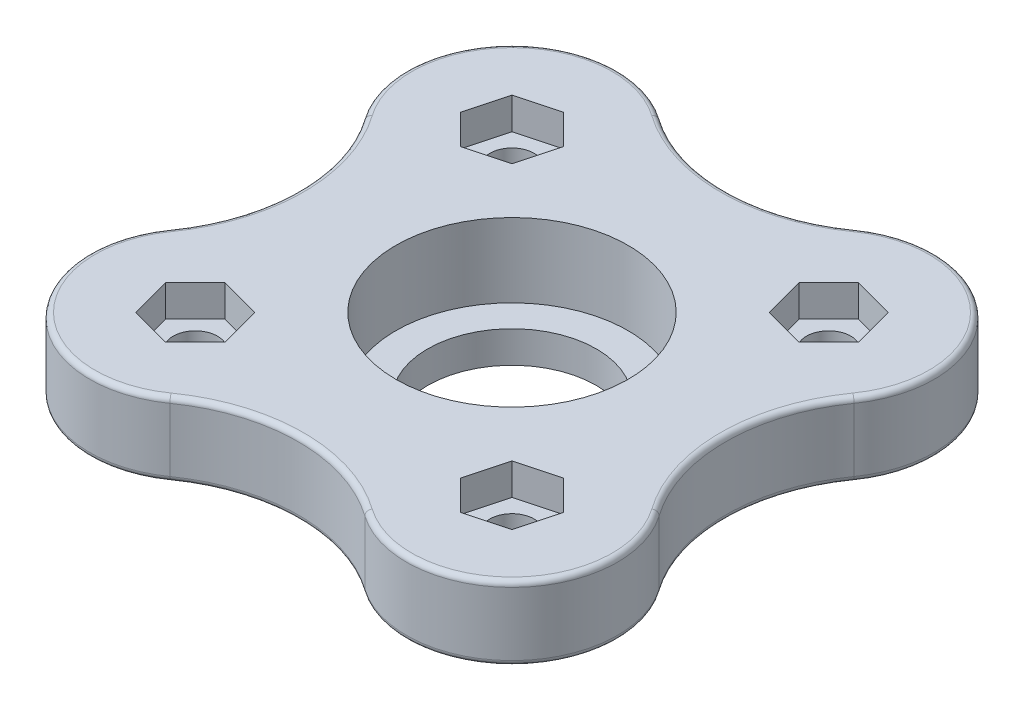
from build123d import *

# Parameters (mm, degrees)
SKETCH1_R           = 11
BOSS_EXTRUDE1_DEPTH = 7
BOSS_EXTRUDE2_START = -3
SKETCH1_3_R         = 13
SKETCH1_3_R_2       = 11
SKETCH1_3_R_3       = 8
BOSS_EXTRUDE2_DEPTH = 3
SKETCH1_4_R         = 2.1
BOSS_EXTRUDE3_DEPTH = 4
FILLET1_R           = 0.5


with BuildPart() as part:
    # Sketch1 → Boss-Extrude1 (new body)
    with BuildSketch(Plane(origin=(0, 0, 0), x_dir=(1, 0, 0), z_dir=(0, 1, 0))):
        with BuildLine():
            ThreePointArc((-23.167984839, 9.230769231), (-22.071067812, 22.071067812), (-9.230769231, 23.167984839))
            ThreePointArc((-9.230769231, 23.167984839), (0, 20.236760582), (9.230769231, 23.167984839))
            ThreePointArc((9.230769231, 23.167984839), (22.071067812, 22.071067812), (23.167984839, 9.230769231))
            ThreePointArc((23.167984839, 9.230769231), (20.236760582, 0), (23.167984839, -9.230769231))
            ThreePointArc((23.167984839, -9.230769231), (22.071067812, -22.071067812), (9.230769231, -23.167984839))
            ThreePointArc((9.230769231, -23.167984839), (0, -20.236760582), (-9.230769231, -23.167984839))
            ThreePointArc((-9.230769231, -23.167984839), (-22.071067812, -22.071067812), (-23.167984839, -9.230769231))
            ThreePointArc((-23.167984839, -9.230769231), (-20.236760582, 0), (-23.167984839, 9.230769231))
        make_face()
        with Locations(Location((0, 0, 0), (0, 0, 270))):
            Circle(SKETCH1_R, mode=Mode.SUBTRACT)
        Polygon((-12.183086796, 12.183086796), (-11.152025003, 16.031061793), (-13.968938207, 18.847974997), (-17.816913204, 17.816913204), (-18.847974997, 13.968938207), (-16.031061793, 11.152025003), align=None, mode=Mode.SUBTRACT)
        Polygon((11.152025003, 16.031061793), (12.183086796, 12.183086796), (16.031061793, 11.152025003), (18.847974997, 13.968938207), (17.816913204, 17.816913204), (13.968938207, 18.847974997), align=None, mode=Mode.SUBTRACT)
        Polygon((11.152025003, -16.031061793), (13.968938207, -18.847974997), (17.816913204, -17.816913204), (18.847974997, -13.968938207), (16.031061793, -11.152025003), (12.183086796, -12.183086796), align=None, mode=Mode.SUBTRACT)
        Polygon((-11.152025003, -16.031061793), (-12.183086796, -12.183086796), (-16.031061793, -11.152025003), (-18.847974997, -13.968938207), (-17.816913204, -17.816913204), (-13.968938207, -18.847974997), align=None, mode=Mode.SUBTRACT)
    extrude(amount=BOSS_EXTRUDE1_DEPTH)

    # Sketch1<3> → Boss-Extrude2 (add)
    # profile 1 of 2: a face of its own
    with BuildSketch(Plane(origin=(0, 0, 0), x_dir=(1, 0, 0), z_dir=(0, 1, 0)).offset(BOSS_EXTRUDE2_START)):
        with Locations(Location((0, 0, 0), (0, 0, 270))):
            Circle(SKETCH1_3_R)
        with Locations(Location((0, 0, 0), (0, 0, 270))):
            Circle(SKETCH1_3_R_2, mode=Mode.SUBTRACT)
    # profile 2 of 2: a face of its own
    with BuildSketch(Plane(origin=(0, 0, 0), x_dir=(1, 0, 0), z_dir=(0, 1, 0)).offset(BOSS_EXTRUDE2_START)):
        with Locations(Location((0, 0, 0), (0, 0, 270))):
            Circle(SKETCH1_3_R_2)
        with Locations(Location((0, 0, 0), (0, 0, 270))):
            Circle(SKETCH1_3_R_3, mode=Mode.SUBTRACT)
    extrude(amount=BOSS_EXTRUDE2_DEPTH)

    # Sketch1<4> → Boss-Extrude3 (add)
    # profile 1 of 4: a face of its own
    with BuildSketch(Plane(origin=(0, 0, 0), x_dir=(1, 0, 0), z_dir=(0, 1, 0))):
        Polygon((-17.816913204, -17.816913204), (-13.968938207, -18.847974997), (-11.152025003, -16.031061793), (-12.183086796, -12.183086796), (-16.031061793, -11.152025003), (-18.847974997, -13.968938207), align=None)
        with Locations(Location((-15, -15, 0), (0, 0, 270))):
            Circle(SKETCH1_4_R, mode=Mode.SUBTRACT)
    # profile 2 of 4: a face of its own
    with BuildSketch(Plane(origin=(0, 0, 0), x_dir=(1, 0, 0), z_dir=(0, 1, 0))):
        Polygon((-18.847974997, 13.968938207), (-16.031061793, 11.152025003), (-12.183086796, 12.183086796), (-11.152025003, 16.031061793), (-13.968938207, 18.847974997), (-17.816913204, 17.816913204), align=None)
        with Locations(Location((-15, 15, 0), (0, 0, 270))):
            Circle(SKETCH1_4_R, mode=Mode.SUBTRACT)
    # profile 3 of 4: a face of its own
    with BuildSketch(Plane(origin=(0, 0, 0), x_dir=(1, 0, 0), z_dir=(0, 1, 0))):
        Polygon((17.816913204, 17.816913204), (13.968938207, 18.847974997), (11.152025003, 16.031061793), (12.183086796, 12.183086796), (16.031061793, 11.152025003), (18.847974997, 13.968938207), align=None)
        with Locations(Location((15, 15, 0), (0, 0, 270))):
            Circle(SKETCH1_4_R, mode=Mode.SUBTRACT)
    # profile 4 of 4: a face of its own
    with BuildSketch(Plane(origin=(0, 0, 0), x_dir=(1, 0, 0), z_dir=(0, 1, 0))):
        Polygon((16.031061793, -11.152025003), (12.183086796, -12.183086796), (11.152025003, -16.031061793), (13.968938207, -18.847974997), (17.816913204, -17.816913204), (18.847974997, -13.968938207), align=None)
        with Locations(Location((15, -15, 0), (0, 0, 270))):
            Circle(SKETCH1_4_R, mode=Mode.SUBTRACT)
    extrude(amount=BOSS_EXTRUDE3_DEPTH)

    # Fillet1
    fillet1_edges = [part.edges().sort_by_distance(p)[0] for p in [
        (0, 7, 20.236760582),
        (0, -3, -13),
        (22.071067812, 7, 22.071067812),
        (20.236760582, 7, 0),
        (22.071067812, 7, -22.071067812),
        (0, 7, -20.236760582),
        (-22.071067812, 7, -22.071067812),
        (-20.236760582, 7, 0),
        (-22.071067812, 7, 22.071067812),
        (-22.071067812, 0, 22.071067812),
        (-20.236760582, 0, 0),
        (-22.071067812, 0, -22.071067812),
        (0, 0, -20.236760582),
        (22.071067812, 0, -22.071067812),
        (20.236760582, 0, 0),
        (22.071067812, 0, 22.071067812),
        (0, 0, 20.236760582),
    ]]
    fillet(fillet1_edges, radius=FILLET1_R)


solid = part.part
